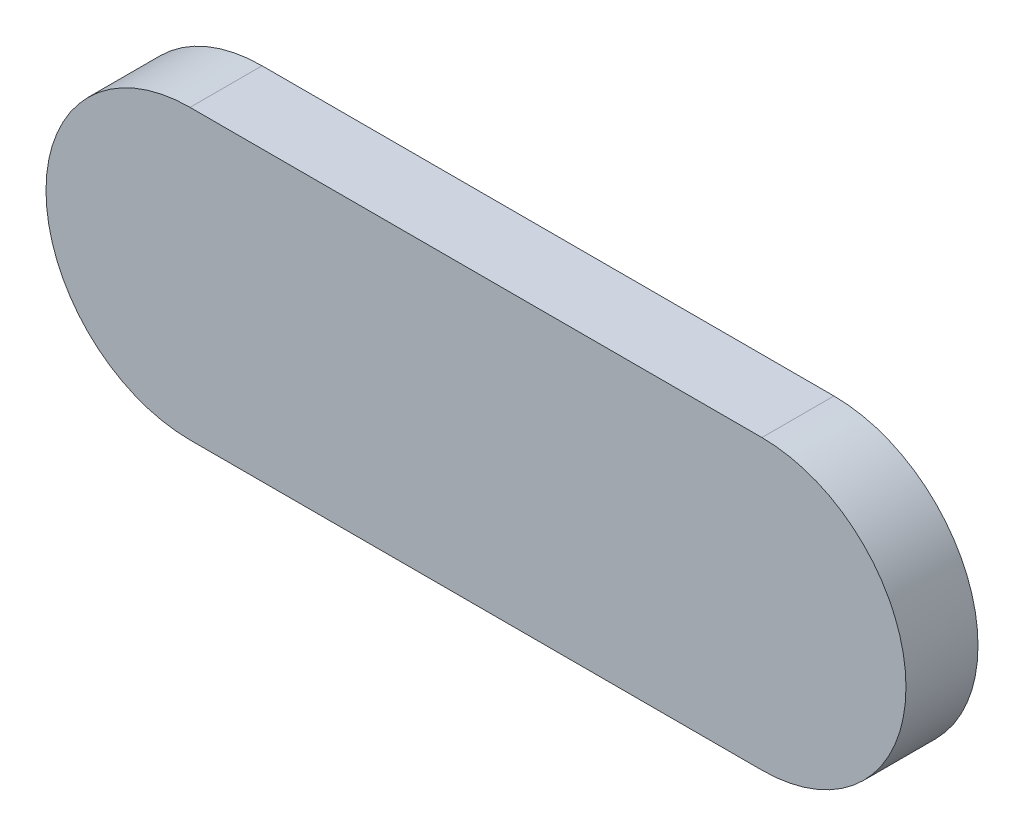
from build123d import *

# Parameters (mm, degrees)
EXTRUDE_2_DEPTH = 5


with BuildPart() as part:
    # Эскиз1 → Бобышка-Вытянуть2 (new body)
    with BuildSketch(Plane.XY):
        with BuildLine():
            Line((-19.85, 10), (19.85, 10))
            ThreePointArc((19.85, 10), (29.85, 0), (19.85, -10))
            Line((19.85, -10), (-19.85, -10))
            ThreePointArc((-19.85, -10), (-29.85, 0), (-19.85, 10))
        make_face()
    extrude(amount=EXTRUDE_2_DEPTH)


solid = part.part
